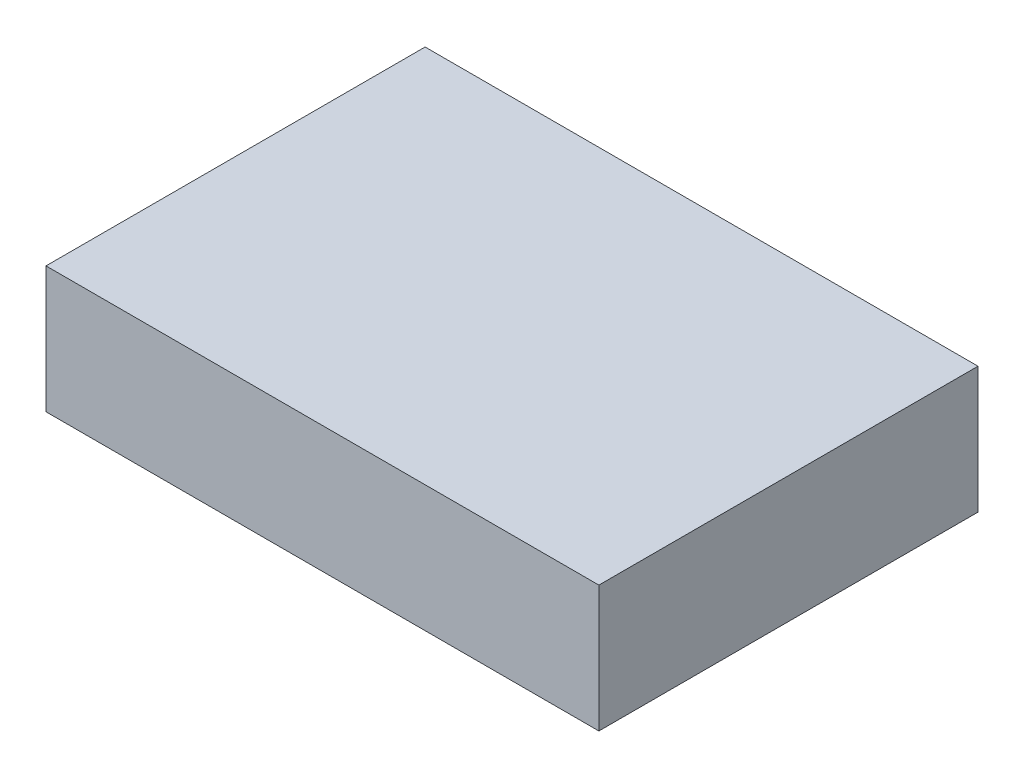
from build123d import *

# Parameters (mm, degrees)
SKETCH1_W           = 35
SKETCH1_H           = 24
BOSS_EXTRUDE1_DEPTH = 8


with BuildPart() as part:
    # Sketch1 → Boss-Extrude1 (new body)
    with BuildSketch(Plane(origin=(0, 0, 0), x_dir=(1, 0, 0), z_dir=(0, 1, 0))):
        Rectangle(SKETCH1_W, SKETCH1_H)
    extrude(amount=BOSS_EXTRUDE1_DEPTH)


solid = part.part
